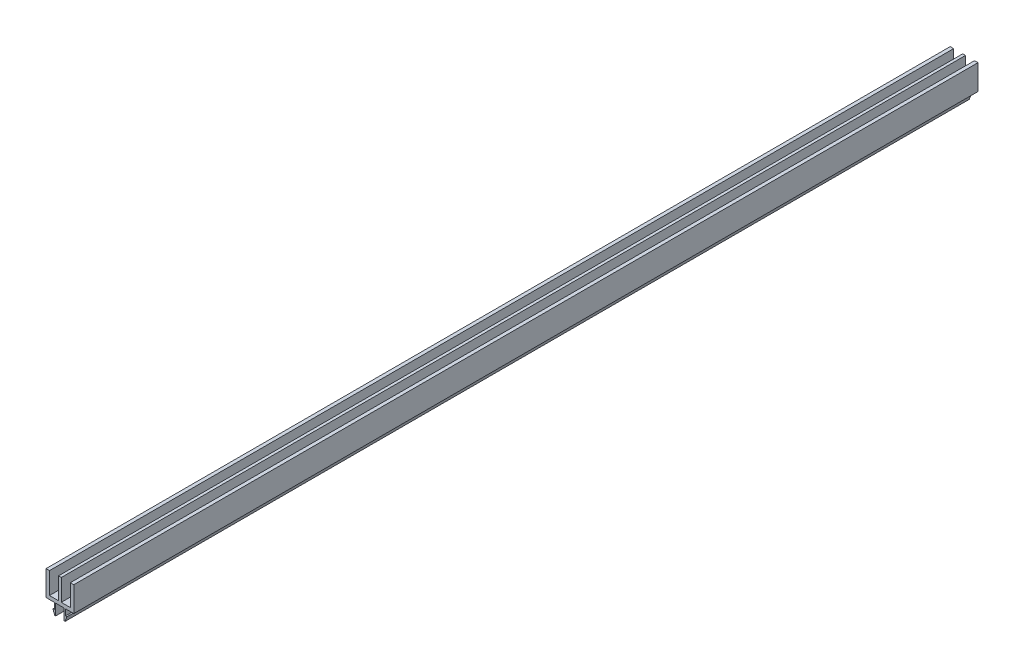
from build123d import *

# Parameters (mm, degrees)
BOSS_EXTRU_1_DEPTH = 650.29


with BuildPart() as part:
    # Esquisse1 → Boss.-Extru.1 (new body)
    with BuildSketch(Plane.XY.offset(50)):
        Polygon((-1, 2.5), (-7.5, 2.5), (-7.5, 17.999999998), (-10, 17.999999998), (-10, 0), (-4, 0), (-4, -4.5), (-5, -4.5), (-3.75, -8), (-3, -8), (-3, 0), (3, 0), (3, -8), (3.75, -8), (5, -4.5), (4, -4.5), (4, 0), (10, 0), (10, 17.999999998), (7.5, 17.999999998), (7.5, 2.5), (1, 2.5), (1, 17.999999998), (-1, 17.999999998), align=None)
    extrude(amount=-BOSS_EXTRU_1_DEPTH)


solid = part.part
